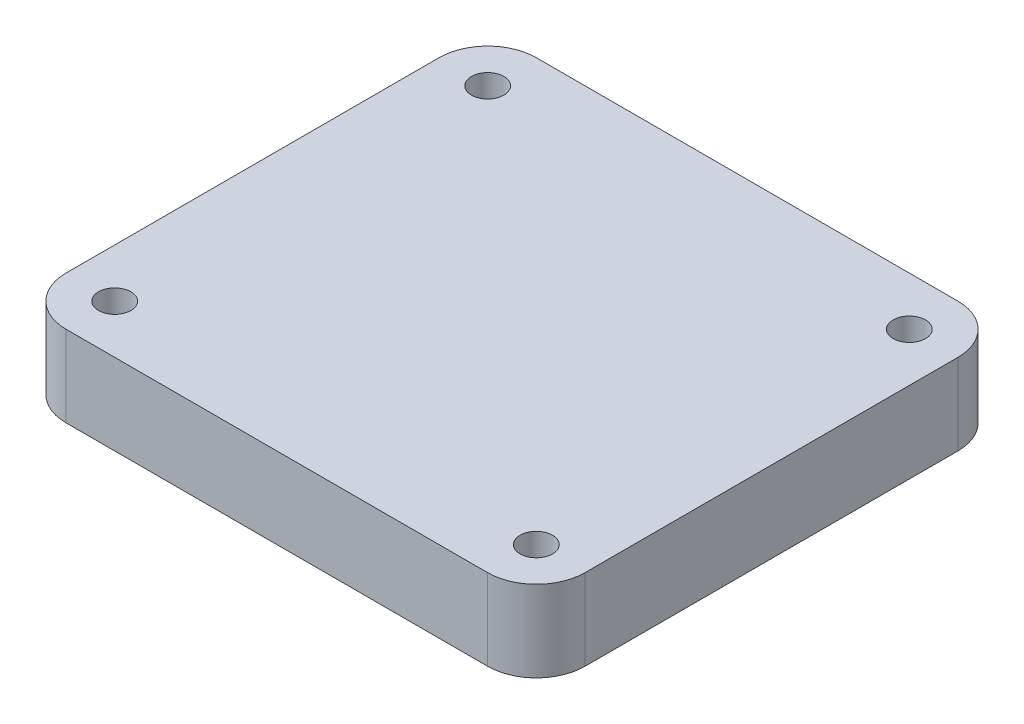
from build123d import *

# Parameters (mm, degrees)
SKETCH_1_R      = 2
EXTRUDE_1_DEPTH = 10
EXTRUDE_START   = 7
EXTRUDE_3_DEPTH = 3


with BuildPart() as part:
    # Эскиз1 → Бобышка-Вытянуть1 (new body)
    with BuildSketch(Plane(origin=(0, 0, 0), x_dir=(1, 0, 0), z_dir=(0, 1, 0))):
        with BuildLine():
            Line((-26, 29), (26, 29))
            ThreePointArc((26, 29), (30.242640687, 27.242640687), (32, 23))
            Line((32, 23), (32, -23))
            ThreePointArc((32, -23), (30.242640687, -27.242640687), (26, -29))
            Line((26, -29), (-26, -29))
            ThreePointArc((-26, -29), (-30.242640687, -27.242640687), (-32, -23))
            Line((-32, -23), (-32, 23))
            ThreePointArc((-32, 23), (-30.242640687, 27.242640687), (-26, 29))
        make_face()
        with Locations(Location((-26, 23, 0), (0, 0, 270))):
            Circle(SKETCH_1_R, mode=Mode.SUBTRACT)
        with Locations(Location((26, 23, 0), (0, 0, 90))):
            Circle(SKETCH_1_R, mode=Mode.SUBTRACT)
        with Locations(Location((26, -23, 0), (0, 0, 270))):
            Circle(SKETCH_1_R, mode=Mode.SUBTRACT)
        with Locations(Location((-26, -23, 0), (0, 0, 90))):
            Circle(SKETCH_1_R, mode=Mode.SUBTRACT)
        with BuildLine():
            Line((7.75, 26), (-16.75, 26))
            ThreePointArc((-16.75, 26), (-18.871320344, 25.121320344), (-19.75, 23))
            ThreePointArc((-19.75, 23), (-21.580582618, 18.580582618), (-26, 16.75))
            ThreePointArc((-26, 16.75), (-28.121320344, 15.871320344), (-29, 13.75))
            Line((-29, 13.75), (-29, -13.75))
            ThreePointArc((-29, -13.75), (-28.121320344, -15.871320344), (-26, -16.75))
            Line((-26, -16.75), (-17, -16.75))
            ThreePointArc((-17, -16.75), (-12.580582618, -18.580582618), (-10.75, -23))
            ThreePointArc((-10.75, -23), (-9.871320344, -25.121320344), (-7.75, -26))
            Line((-7.75, -26), (16.75, -26))
            ThreePointArc((16.75, -26), (18.871320344, -25.121320344), (19.75, -23))
            ThreePointArc((19.75, -23), (21.580582618, -18.580582618), (26, -16.75))
            ThreePointArc((26, -16.75), (28.121320344, -15.871320344), (29, -13.75))
            Line((29, -13.75), (29, 13.75))
            ThreePointArc((29, 13.75), (28.121320344, 15.871320344), (26, 16.75))
            Line((26, 16.75), (17, 16.75))
            ThreePointArc((17, 16.75), (12.580582618, 18.580582618), (10.75, 23))
            ThreePointArc((10.75, 23), (9.871320344, 25.121320344), (7.75, 26))
        make_face(mode=Mode.SUBTRACT)
        with BuildLine():
            Line((17, 18.75), (23.366086562, 18.75))
            ThreePointArc((23.366086562, 18.75), (21.020896599, 22.543349889), (22.636965656, 26.7))
            Line((22.636965656, 26.7), (11.113034344, 26.7))
            ThreePointArc((11.113034344, 26.7), (12.322481368, 25.022971611), (12.75, 23))
            ThreePointArc((12.75, 23), (13.99479618, 19.99479618), (17, 18.75))
        make_face(mode=Mode.SUBTRACT)
        with BuildLine():
            Line((-22.636965656, -26.7), (-11.113034344, -26.7))
            ThreePointArc((-11.113034344, -26.7), (-12.322481368, -25.022971611), (-12.75, -23))
            ThreePointArc((-12.75, -23), (-13.99479618, -19.99479618), (-17, -18.75))
            Line((-17, -18.75), (-23.366086562, -18.75))
            ThreePointArc((-23.366086562, -18.75), (-21.020896599, -22.543349889), (-22.636965656, -26.7))
        make_face(mode=Mode.SUBTRACT)
    extrude(amount=EXTRUDE_1_DEPTH)

    # Эскиз1<15> → Бобышка-Вытянуть3 (add)
    with BuildSketch(Plane(origin=(0, 0, 0), x_dir=(1, 0, 0), z_dir=(0, 1, 0)).offset(EXTRUDE_START)):
        with BuildLine():
            ThreePointArc((-17, -16.75), (-12.580582618, -18.580582618), (-10.75, -23))
            ThreePointArc((-10.75, -23), (-9.871320344, -25.121320344), (-7.75, -26))
            Line((-7.75, -26), (16.75, -26))
            ThreePointArc((16.75, -26), (18.871320344, -25.121320344), (19.75, -23))
            ThreePointArc((19.75, -23), (21.580582618, -18.580582618), (26, -16.75))
            ThreePointArc((26, -16.75), (28.121320344, -15.871320344), (29, -13.75))
            Line((29, -13.75), (29, 13.75))
            ThreePointArc((29, 13.75), (28.121320344, 15.871320344), (26, 16.75))
            Line((26, 16.75), (17, 16.75))
            ThreePointArc((17, 16.75), (12.580582618, 18.580582618), (10.75, 23))
            ThreePointArc((10.75, 23), (9.871320344, 25.121320344), (7.75, 26))
            Line((7.75, 26), (-16.75, 26))
            ThreePointArc((-16.75, 26), (-18.871320344, 25.121320344), (-19.75, 23))
            ThreePointArc((-19.75, 23), (-21.580582618, 18.580582618), (-26, 16.75))
            ThreePointArc((-26, 16.75), (-28.121320344, 15.871320344), (-29, 13.75))
            Line((-29, 13.75), (-29, -13.75))
            ThreePointArc((-29, -13.75), (-28.121320344, -15.871320344), (-26, -16.75))
            Line((-26, -16.75), (-17, -16.75))
        make_face()
        with BuildLine():
            ThreePointArc((12.75, 23), (12.322481368, 25.022971611), (11.113034344, 26.7))
            Line((11.113034344, 26.7), (22.636965656, 26.7))
            ThreePointArc((22.636965656, 26.7), (21.020896599, 22.543349889), (23.366086562, 18.75))
            Line((23.366086562, 18.75), (17, 18.75))
            ThreePointArc((17, 18.75), (13.99479618, 19.99479618), (12.75, 23))
        make_face()
        with BuildLine():
            ThreePointArc((-12.75, -23), (-12.322481368, -25.022971611), (-11.113034344, -26.7))
            Line((-11.113034344, -26.7), (-22.636965656, -26.7))
            ThreePointArc((-22.636965656, -26.7), (-21.020896599, -22.543349889), (-23.366086562, -18.75))
            Line((-23.366086562, -18.75), (-17, -18.75))
            ThreePointArc((-17, -18.75), (-13.99479618, -19.99479618), (-12.75, -23))
        make_face()
    extrude(amount=EXTRUDE_3_DEPTH)


solid = part.part
